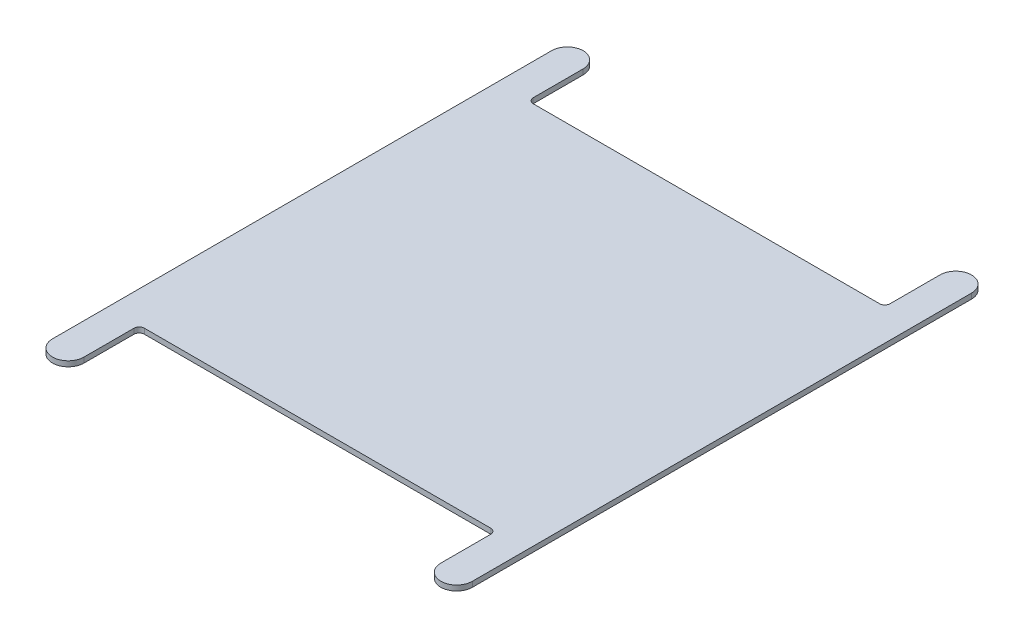
from build123d import *

# Parameters (mm, degrees)
BOSS_EXTRUDE1_START = 12.827
BOSS_EXTRUDE1_DEPTH = 3.175
FILLET1_R           = 3.175


with BuildPart() as part:
    # Sketch1 → Boss-Extrude1 (new body)
    with BuildSketch(Plane(origin=(0, 144.904574554, 0), x_dir=(-1, 0, 0), z_dir=(0, -1, 0)).offset(BOSS_EXTRUDE1_START)):
        with BuildLine():
            Line((-107.823062484, -1103.050334154), (0, -1103.050334154))
            Line((0, -1103.050334154), (0, -1338.000334154))
            Line((0, -1338.000334154), (-107.823062484, -1338.000334154))
            Line((-107.823062484, -1338.000334154), (-107.823062484, -1371.337834154))
            ThreePointArc((-107.823062484, -1371.337834154), (-117.348062484, -1380.862834154), (-126.873062484, -1371.337834154))
            Line((-126.873062484, -1371.337834154), (-126.873062484, -1069.712834154))
            ThreePointArc((-126.873062484, -1069.712834154), (-117.348062484, -1060.187834154), (-107.823062484, -1069.712834154))
            Line((-107.823062484, -1069.712834154), (-107.823062484, -1103.050334154))
        make_face()
    extrude(amount=BOSS_EXTRUDE1_DEPTH)

    # Mirror1: part across plane


with BuildPart() as part_1:
    add(part.part)
    add(part.part.mirror(Plane(origin=(0, 0, 0), x_dir=(0, 0, 1), z_dir=(1, 0, 0))))

    # Fillet1
    fillet1_edges = [part_1.edges().sort_by_distance(p)[0] for p in [
        (107.823062484, 130.490074554, 1103.050334154),
        (107.823062484, 130.490074554, 1338.000334154),
        (-107.823062484, 130.490074554, 1338.000334154),
        (-107.823062484, 130.490074554, 1103.050334154),
    ]]
    fillet(fillet1_edges, radius=FILLET1_R)


solid = part_1.part
